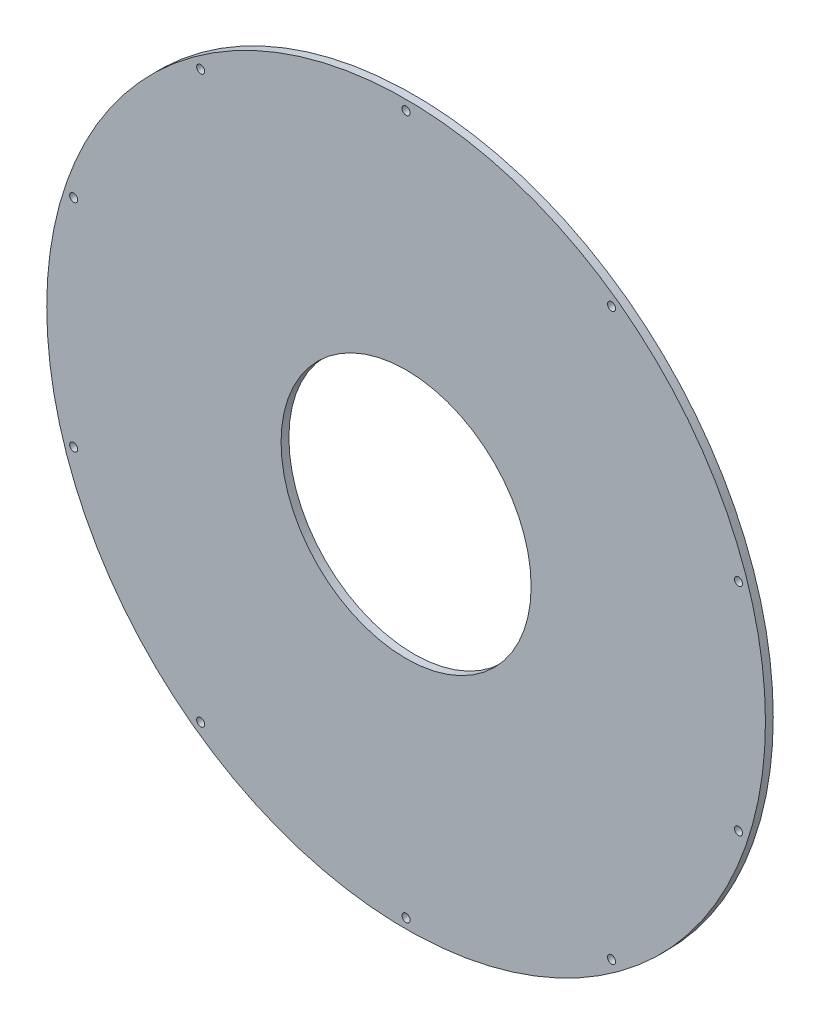
from build123d import *

# Parameters (mm, degrees)
SKETCH1_R             = 146
SKETCH1_R_2           = 50.8
BOSS_EXTRUDE1_DEPTH   = 3.175
F_4_CLEARANCE_HOLE1_D = 3.2639
CIRPATTERN1_COUNT     = 10


with BuildPart() as part:
    # Sketch1 → Boss-Extrude1 (new body)
    with BuildSketch(Plane.XY):
        Circle(SKETCH1_R)
        Circle(SKETCH1_R_2, mode=Mode.SUBTRACT)
    extrude(amount=BOSS_EXTRUDE1_DEPTH)

    # #4 Clearance Hole1 (through all)
    with Locations(Plane.XY.offset(3.175)):
        with Locations((0, 142)):
            f_4_clearance_hole1 = Hole(F_4_CLEARANCE_HOLE1_D / 2)

    # CirPattern1: #4 Clearance Hole1 ×10 about axis
    cirpattern1_axis = Axis((0, 0, 0), (0, 0, 1))
    for i in range(1, CIRPATTERN1_COUNT):
        add(f_4_clearance_hole1.rotate(cirpattern1_axis, i * 360 / CIRPATTERN1_COUNT), mode=Mode.SUBTRACT)


solid = part.part
